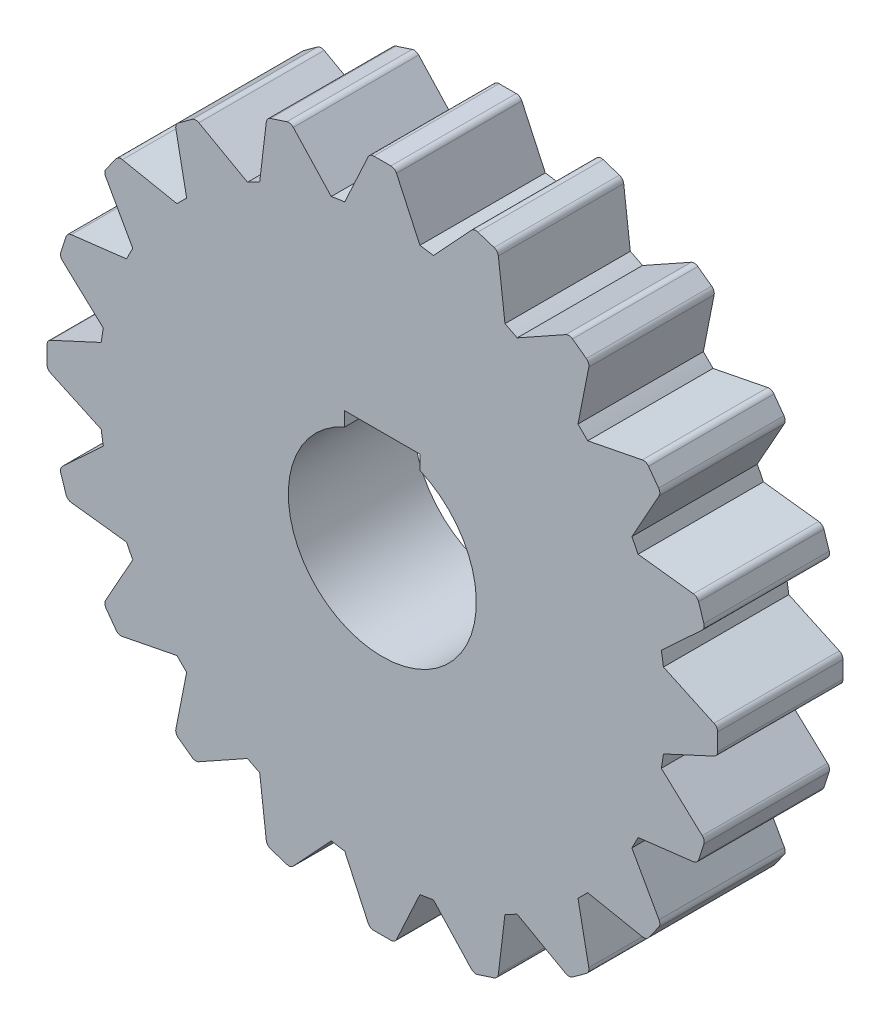
from build123d import *

# Parameters (mm, degrees)
BOSS_EXTRUDE1_DEPTH = 20


with BuildPart() as part:
    # Sketch1 → Boss-Extrude1 (new body)
    with BuildSketch(Plane.XY):
        with BuildLine():
            Line((-1.360697771, 53.5), (1.360697771, 53.5))
            ThreePointArc((1.360697771, 53.5), (1.899334334, 53.342538221), (2.268341553, 52.919741307))
            Line((2.268341553, 52.919741307), (6, 44.850445929))
            ThreePointArc((6, 44.850445929), (7.078659543, 44.692897412), (8.153210899, 44.509410825))
            Line((8.153210899, 44.509410825), (14.195778386, 51.030620899))
            ThreePointArc((14.195778386, 51.030620899), (14.677376539, 51.318695158), (15.238308717, 51.302002357))
            Line((15.238308717, 51.302002357), (17.826509681, 50.461044886))
            ThreePointArc((17.826509681, 50.461044886), (18.290125128, 50.144841983), (18.510420417, 49.628708722))
            Line((18.510420417, 49.628708722), (19.565889095, 40.801206893))
            ThreePointArc((19.565889095, 40.801206893), (20.543070113, 40.31804522), (21.508328709, 39.811484475))
            Line((21.508328709, 39.811484475), (29.27031663, 44.146267767))
            ThreePointArc((29.27031663, 44.146267767), (29.817363532, 44.271420654), (30.345683377, 44.082207282))
            Line((30.345683377, 44.082207282), (32.547338618, 42.482611117))
            ThreePointArc((32.547338618, 42.482611117), (32.89055104, 42.038619233), (32.940570361, 41.479672343))
            Line((32.940570361, 41.479672343), (31.216532642, 32.758061448))
            ThreePointArc((31.216532642, 32.758061448), (31.996581849, 31.996581849), (32.758061448, 31.216532642))
            Line((32.758061448, 31.216532642), (41.479672343, 32.940570361))
            ThreePointArc((41.479672343, 32.940570361), (42.038619233, 32.89055104), (42.482611117, 32.547338618))
            Line((42.482611117, 32.547338618), (44.082207282, 30.345683377))
            ThreePointArc((44.082207282, 30.345683377), (44.271420654, 29.817363532), (44.146267767, 29.27031663))
            Line((44.146267767, 29.27031663), (39.811484475, 21.508328709))
            ThreePointArc((39.811484475, 21.508328709), (40.31804522, 20.543070113), (40.801206893, 19.565889095))
            Line((40.801206893, 19.565889095), (49.628708722, 18.510420417))
            ThreePointArc((49.628708722, 18.510420417), (50.144841983, 18.290125128), (50.461044886, 17.826509681))
            Line((50.461044886, 17.826509681), (51.302002357, 15.238308717))
            ThreePointArc((51.302002357, 15.238308717), (51.318695158, 14.677376539), (51.030620899, 14.195778386))
            Line((51.030620899, 14.195778386), (44.509410825, 8.153210899))
            ThreePointArc((44.509410825, 8.153210899), (44.692897412, 7.078659543), (44.850445929, 6))
            Line((44.850445929, 6), (52.919741307, 2.268341553))
            ThreePointArc((52.919741307, 2.268341553), (53.342538221, 1.899334334), (53.5, 1.360697771))
            Line((53.5, 1.360697771), (53.5, -1.360697771))
            ThreePointArc((53.5, -1.360697771), (53.342538221, -1.899334334), (52.919741307, -2.268341553))
            Line((52.919741307, -2.268341553), (44.850445929, -6))
            ThreePointArc((44.850445929, -6), (44.692897412, -7.078659543), (44.509410825, -8.153210899))
            Line((44.509410825, -8.153210899), (51.030620899, -14.195778386))
            ThreePointArc((51.030620899, -14.195778386), (51.318695158, -14.677376539), (51.302002357, -15.238308717))
            Line((51.302002357, -15.238308717), (50.461044886, -17.826509681))
            ThreePointArc((50.461044886, -17.826509681), (50.144841983, -18.290125128), (49.628708722, -18.510420417))
            Line((49.628708722, -18.510420417), (40.801206893, -19.565889095))
            ThreePointArc((40.801206893, -19.565889095), (40.31804522, -20.543070113), (39.811484475, -21.508328709))
            Line((39.811484475, -21.508328709), (44.146267767, -29.27031663))
            ThreePointArc((44.146267767, -29.27031663), (44.271420654, -29.817363532), (44.082207282, -30.345683377))
            Line((44.082207282, -30.345683377), (42.482611117, -32.547338618))
            ThreePointArc((42.482611117, -32.547338618), (42.038619233, -32.89055104), (41.479672343, -32.940570361))
            Line((41.479672343, -32.940570361), (32.758061448, -31.216532642))
            ThreePointArc((32.758061448, -31.216532642), (31.996581849, -31.996581849), (31.216532642, -32.758061448))
            Line((31.216532642, -32.758061448), (32.940570361, -41.479672343))
            ThreePointArc((32.940570361, -41.479672343), (32.89055104, -42.038619233), (32.547338618, -42.482611117))
            Line((32.547338618, -42.482611117), (30.345683377, -44.082207282))
            ThreePointArc((30.345683377, -44.082207282), (29.817363532, -44.271420654), (29.27031663, -44.146267767))
            Line((29.27031663, -44.146267767), (21.508328709, -39.811484475))
            ThreePointArc((21.508328709, -39.811484475), (20.543070113, -40.31804522), (19.565889095, -40.801206893))
            Line((19.565889095, -40.801206893), (18.510420417, -49.628708722))
            ThreePointArc((18.510420417, -49.628708722), (18.290125128, -50.144841983), (17.826509681, -50.461044886))
            Line((17.826509681, -50.461044886), (15.238308717, -51.302002357))
            ThreePointArc((15.238308717, -51.302002357), (14.677376539, -51.318695158), (14.195778386, -51.030620899))
            Line((14.195778386, -51.030620899), (8.153210899, -44.509410825))
            ThreePointArc((8.153210899, -44.509410825), (7.078659543, -44.692897412), (6, -44.850445929))
            Line((6, -44.850445929), (2.268341553, -52.919741307))
            ThreePointArc((2.268341553, -52.919741307), (1.899334334, -53.342538221), (1.360697771, -53.5))
            Line((1.360697771, -53.5), (-1.360697771, -53.5))
            ThreePointArc((-1.360697771, -53.5), (-1.899334334, -53.342538221), (-2.268341553, -52.919741307))
            Line((-2.268341553, -52.919741307), (-6, -44.850445929))
            ThreePointArc((-6, -44.850445929), (-7.078659543, -44.692897412), (-8.153210899, -44.509410825))
            Line((-8.153210899, -44.509410825), (-14.195778386, -51.030620899))
            ThreePointArc((-14.195778386, -51.030620899), (-14.677376539, -51.318695158), (-15.238308717, -51.302002357))
            Line((-15.238308717, -51.302002357), (-17.826509681, -50.461044886))
            ThreePointArc((-17.826509681, -50.461044886), (-18.290125128, -50.144841983), (-18.510420417, -49.628708722))
            Line((-18.510420417, -49.628708722), (-19.565889095, -40.801206893))
            ThreePointArc((-19.565889095, -40.801206893), (-20.543070113, -40.31804522), (-21.508328709, -39.811484475))
            Line((-21.508328709, -39.811484475), (-29.27031663, -44.146267767))
            ThreePointArc((-29.27031663, -44.146267767), (-29.817363532, -44.271420654), (-30.345683377, -44.082207282))
            Line((-30.345683377, -44.082207282), (-32.547338618, -42.482611117))
            ThreePointArc((-32.547338618, -42.482611117), (-32.89055104, -42.038619233), (-32.940570361, -41.479672343))
            Line((-32.940570361, -41.479672343), (-31.216532642, -32.758061448))
            ThreePointArc((-31.216532642, -32.758061448), (-31.996581849, -31.996581849), (-32.758061448, -31.216532642))
            Line((-32.758061448, -31.216532642), (-41.479672343, -32.940570361))
            ThreePointArc((-41.479672343, -32.940570361), (-42.038619233, -32.89055104), (-42.482611117, -32.547338618))
            Line((-42.482611117, -32.547338618), (-44.082207282, -30.345683377))
            ThreePointArc((-44.082207282, -30.345683377), (-44.271420654, -29.817363532), (-44.146267767, -29.27031663))
            Line((-44.146267767, -29.27031663), (-39.811484475, -21.508328709))
            ThreePointArc((-39.811484475, -21.508328709), (-40.31804522, -20.543070113), (-40.801206893, -19.565889095))
            Line((-40.801206893, -19.565889095), (-49.628708722, -18.510420417))
            ThreePointArc((-49.628708722, -18.510420417), (-50.144841983, -18.290125128), (-50.461044886, -17.826509681))
            Line((-50.461044886, -17.826509681), (-51.302002357, -15.238308717))
            ThreePointArc((-51.302002357, -15.238308717), (-51.318695158, -14.677376539), (-51.030620899, -14.195778386))
            Line((-51.030620899, -14.195778386), (-44.509410825, -8.153210899))
            ThreePointArc((-44.509410825, -8.153210899), (-44.692897412, -7.078659543), (-44.850445929, -6))
            Line((-44.850445929, -6), (-52.919741307, -2.268341553))
            ThreePointArc((-52.919741307, -2.268341553), (-53.342538221, -1.899334334), (-53.5, -1.360697771))
            Line((-53.5, -1.360697771), (-53.5, 1.360697771))
            ThreePointArc((-53.5, 1.360697771), (-53.342538221, 1.899334334), (-52.919741307, 2.268341553))
            Line((-52.919741307, 2.268341553), (-44.850445929, 6))
            ThreePointArc((-44.850445929, 6), (-44.692897412, 7.078659543), (-44.509410825, 8.153210899))
            Line((-44.509410825, 8.153210899), (-51.030620899, 14.195778386))
            ThreePointArc((-51.030620899, 14.195778386), (-51.318695158, 14.677376539), (-51.302002357, 15.238308717))
            Line((-51.302002357, 15.238308717), (-50.461044886, 17.826509681))
            ThreePointArc((-50.461044886, 17.826509681), (-50.144841983, 18.290125128), (-49.628708722, 18.510420417))
            Line((-49.628708722, 18.510420417), (-40.801206893, 19.565889095))
            ThreePointArc((-40.801206893, 19.565889095), (-40.31804522, 20.543070113), (-39.811484475, 21.508328709))
            Line((-39.811484475, 21.508328709), (-44.146267767, 29.27031663))
            ThreePointArc((-44.146267767, 29.27031663), (-44.271420654, 29.817363532), (-44.082207282, 30.345683377))
            Line((-44.082207282, 30.345683377), (-42.482611117, 32.547338618))
            ThreePointArc((-42.482611117, 32.547338618), (-42.038619233, 32.89055104), (-41.479672343, 32.940570361))
            Line((-41.479672343, 32.940570361), (-32.758061448, 31.216532642))
            ThreePointArc((-32.758061448, 31.216532642), (-31.996581849, 31.996581849), (-31.216532642, 32.758061448))
            Line((-31.216532642, 32.758061448), (-32.940570361, 41.479672343))
            ThreePointArc((-32.940570361, 41.479672343), (-32.89055104, 42.038619233), (-32.547338618, 42.482611117))
            Line((-32.547338618, 42.482611117), (-30.345683377, 44.082207282))
            ThreePointArc((-30.345683377, 44.082207282), (-29.817363532, 44.271420654), (-29.27031663, 44.146267767))
            Line((-29.27031663, 44.146267767), (-21.508328709, 39.811484475))
            ThreePointArc((-21.508328709, 39.811484475), (-20.543070113, 40.31804522), (-19.565889095, 40.801206893))
            Line((-19.565889095, 40.801206893), (-18.510420417, 49.628708722))
            ThreePointArc((-18.510420417, 49.628708722), (-18.290125128, 50.144841983), (-17.826509681, 50.461044886))
            Line((-17.826509681, 50.461044886), (-15.238308717, 51.302002357))
            ThreePointArc((-15.238308717, 51.302002357), (-14.677376539, 51.318695158), (-14.195778386, 51.030620899))
            Line((-14.195778386, 51.030620899), (-8.153210899, 44.509410825))
            ThreePointArc((-8.153210899, 44.509410825), (-7.078659543, 44.692897412), (-6, 44.850445929))
            Line((-6, 44.850445929), (-2.268341553, 52.919741307))
            ThreePointArc((-2.268341553, 52.919741307), (-1.899334334, 53.342538221), (-1.360697771, 53.5))
        make_face()
        with BuildLine():
            Line((6, 13.747727085), (6, 15.997727085))
            Line((6, 15.997727085), (-6, 15.997727085))
            Line((-6, 15.997727085), (-6, 13.747727085))
            ThreePointArc((-6, 13.747727085), (0, -15), (6, 13.747727085))
        make_face(mode=Mode.SUBTRACT)
    extrude(amount=-BOSS_EXTRUDE1_DEPTH)


solid = part.part
